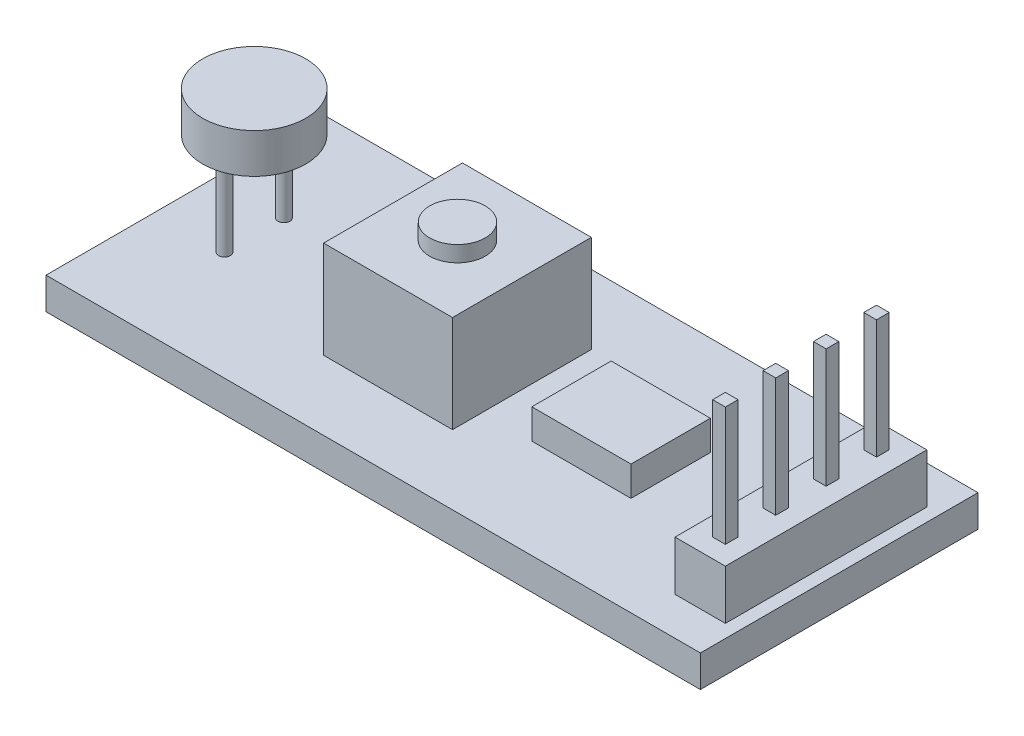
from build123d import *

# Parameters (mm, degrees)
SK_PCB_W            = 33
SK_PCB_H            = 14
PCB_DEPTH           = 1.6
LDR_START           = 1.6
SK_LDR_LEGS_R       = 0.3
LDR_LEGS_DEPTH      = 4.4
LDR_LEGS_2_DEPTH    = 4.4
LDR_START_2         = 6
SK_LDR_CELL_R       = 2.6
LDR_CELL_DEPTH      = 2
TRIM_START          = 1.6
SK_TRIM_POT_W       = 6.5
SK_TRIM_POT_H       = 7
TRIM_POT_DEPTH      = 4.9
POT_START           = 6.5
SK_POT_SCREW_R      = 1.4
POT_SCREW_DEPTH     = 0.8
LM393_START         = 1.6
SK_LM393_W          = 5
SK_LM393_H          = 4
LM393_DEPTH         = 1.5
HEADER_START        = 1.6
SK_HEADER_4_PIN_W   = 2.54
SK_HEADER_4_PIN_H   = 10.16
HEADER_4_PIN_DEPTH  = 2.5
HEADER_START_2      = 4.1
SK_HEADER_PINS_W    = 0.64
SK_HEADER_PINS_H    = 0.64
HEADER_PINS_DEPTH   = 6
HEADER_PINS_2_DEPTH = 6
HEADER_PINS_3_DEPTH = 6
HEADER_PINS_4_DEPTH = 6


with BuildPart() as part:
    # SK PCB → PCB (new body)
    with BuildSketch(Plane(origin=(0, 0, 0), x_dir=(1, 0, 0), z_dir=(0, 1, 0))):
        with Locations((16.5, 7)):
            Rectangle(SK_PCB_W, SK_PCB_H)
    extrude(amount=PCB_DEPTH)


with BuildPart() as body_2:
    # SK LDR legs → LDR legs (new body)
    with BuildSketch(Plane(origin=(0, 0, 0), x_dir=(1, 0, 0), z_dir=(0, 1, 0)).offset(LDR_START)):
        with Locations(Location((3.5, 5.5, 0), (0, 0, 270))):
            Circle(SK_LDR_LEGS_R)
    extrude(amount=LDR_LEGS_DEPTH)


with BuildPart() as body_3:
    # SK LDR legs → LDR legs 2 (new body)
    with BuildSketch(Plane(origin=(0, 0, 0), x_dir=(1, 0, 0), z_dir=(0, 1, 0)).offset(LDR_START)):
        with Locations(Location((3.5, 8.5, 0), (0, 0, 270))):
            Circle(SK_LDR_LEGS_R)
    extrude(amount=LDR_LEGS_2_DEPTH)


with BuildPart() as body_4:
    # SK LDR cell → LDR cell (new body)
    with BuildSketch(Plane(origin=(0, 0, 0), x_dir=(1, 0, 0), z_dir=(0, 1, 0)).offset(LDR_START_2)):
        with Locations(Location((3.5, 7, 0), (0, 0, 270))):
            Circle(SK_LDR_CELL_R)
    extrude(amount=LDR_CELL_DEPTH)


with BuildPart() as body_5:
    # SK Trim pot → Trim pot (new body)
    with BuildSketch(Plane(origin=(0, 0, 0), x_dir=(1, 0, 0), z_dir=(0, 1, 0)).offset(TRIM_START)):
        with Locations((13.75, 7)):
            Rectangle(SK_TRIM_POT_W, SK_TRIM_POT_H)
    extrude(amount=TRIM_POT_DEPTH)


with BuildPart() as body_6:
    # SK Pot screw → Pot screw (new body)
    with BuildSketch(Plane(origin=(0, 0, 0), x_dir=(1, 0, 0), z_dir=(0, 1, 0)).offset(POT_START)):
        with Locations(Location((13.75, 7, 0), (0, 0, 270))):
            Circle(SK_POT_SCREW_R)
    extrude(amount=POT_SCREW_DEPTH)


with BuildPart() as body_7:
    # SK LM393 → LM393 (new body)
    with BuildSketch(Plane(origin=(0, 0, 0), x_dir=(1, 0, 0), z_dir=(0, 1, 0)).offset(LM393_START)):
        with Locations((22, 7)):
            Rectangle(SK_LM393_W, SK_LM393_H)
    extrude(amount=LM393_DEPTH)


with BuildPart() as body_8:
    # SK Header 4 pin → Header 4 pin (new body)
    with BuildSketch(Plane(origin=(0, 0, 0), x_dir=(1, 0, 0), z_dir=(0, 1, 0)).offset(HEADER_START)):
        with Locations((31.07, 7)):
            Rectangle(SK_HEADER_4_PIN_W, SK_HEADER_4_PIN_H)
    extrude(amount=HEADER_4_PIN_DEPTH)


with BuildPart() as body_9:
    # SK Header pins → Header pins (new body)
    with BuildSketch(Plane(origin=(0, 0, 0), x_dir=(1, 0, 0), z_dir=(0, 1, 0)).offset(HEADER_START_2)):
        with Locations((31.07, 10.81)):
            Rectangle(SK_HEADER_PINS_W, SK_HEADER_PINS_H)
    extrude(amount=HEADER_PINS_DEPTH)


with BuildPart() as body_10:
    # SK Header pins → Header pins 2 (new body)
    with BuildSketch(Plane(origin=(0, 0, 0), x_dir=(1, 0, 0), z_dir=(0, 1, 0)).offset(HEADER_START_2)):
        with Locations((31.07, 8.27)):
            Rectangle(SK_HEADER_PINS_W, SK_HEADER_PINS_H)
    extrude(amount=HEADER_PINS_2_DEPTH)


with BuildPart() as body_11:
    # SK Header pins → Header pins 3 (new body)
    with BuildSketch(Plane(origin=(0, 0, 0), x_dir=(1, 0, 0), z_dir=(0, 1, 0)).offset(HEADER_START_2)):
        with Locations((31.07, 5.73)):
            Rectangle(SK_HEADER_PINS_W, SK_HEADER_PINS_H)
    extrude(amount=HEADER_PINS_3_DEPTH)


with BuildPart() as body_12:
    # SK Header pins → Header pins 4 (new body)
    with BuildSketch(Plane(origin=(0, 0, 0), x_dir=(1, 0, 0), z_dir=(0, 1, 0)).offset(HEADER_START_2)):
        with Locations((31.07, 3.19)):
            Rectangle(SK_HEADER_PINS_W, SK_HEADER_PINS_H)
    extrude(amount=HEADER_PINS_4_DEPTH)


solid = Compound([part.part, body_2.part, body_3.part, body_4.part, body_5.part, body_6.part, body_7.part, body_8.part, body_9.part, body_10.part, body_11.part, body_12.part])
